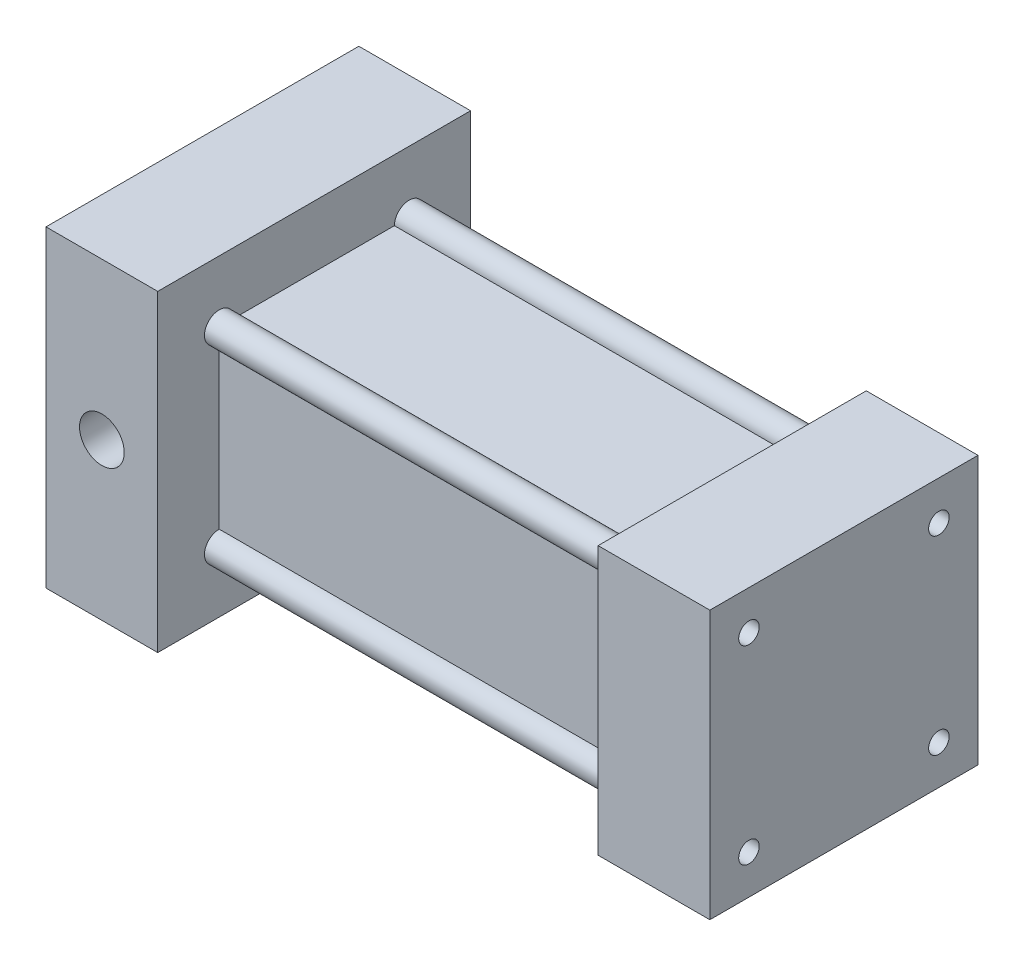
from build123d import *

# Parameters (mm, degrees)
SKETCH1_W           = 15.875
SKETCH1_H           = 44.45
BASE_EXTRUDE_DEPTH  = 22.225
SKETCH2_W           = 26.98496
SKETCH2_H           = 26.98496
BOSS_EXTRUDE1_DEPTH = 59.39536
SKETCH3_W           = 38.1
SKETCH3_H           = 38.1
BOSS_EXTRUDE2_DEPTH = 15.875
SKETCH4_R           = 2.09296
BOSS_EXTRUDE3_DEPTH = 59.39536
SKETCH5_R           = 1.45796
CUT_EXTRUDE1_DEPTH  = 75.27036
SKETCH6_R           = 4.7625
CUT_EXTRUDE2_DEPTH  = 75.27036
SKETCH8_R           = 3.175
CUT_EXTRUDE3_DEPTH  = 6.35


with BuildPart() as part:
    # Sketch1 → Base-Extrude (new, symmetric)
    with BuildSketch(Plane.XY):
        Rectangle(SKETCH1_W, SKETCH1_H)
    extrude(amount=BASE_EXTRUDE_DEPTH, both=True)

    # Sketch2 → Boss-Extrude1 (add)
    with BuildSketch(Plane(origin=(7.9375, 0, 0), x_dir=(0, 0, -1), z_dir=(1, 0, 0))):
        Rectangle(SKETCH2_W, SKETCH2_H)
    extrude(amount=BOSS_EXTRUDE1_DEPTH)

    # Sketch3 → Boss-Extrude2 (add)
    with BuildSketch(Plane(origin=(67.33286, -2.916482086, 3.369055623), x_dir=(0, 0, -1), z_dir=(1, 0, 0))):
        with Locations((3.369055623, 2.916482086)):
            Rectangle(SKETCH3_W, SKETCH3_H)
    extrude(amount=BOSS_EXTRUDE2_DEPTH)

    # Sketch4 → Boss-Extrude3 (add)
    with BuildSketch(Plane(origin=(7.9375, 0, 0), x_dir=(0, 0, -1), z_dir=(1, 0, 0))):
        with Locations((-13.49248, 13.49248)):
            Circle(SKETCH4_R)
        with Locations((-13.49248, -13.49248)):
            Circle(SKETCH4_R)
        with Locations((13.49248, 13.49248)):
            Circle(SKETCH4_R)
        with Locations((13.49248, -13.49248)):
            Circle(SKETCH4_R)
    extrude(amount=BOSS_EXTRUDE3_DEPTH)

    # Sketch5 → Cut-Extrude1 (cut)
    with BuildSketch(Plane(origin=(83.20786, 0, 0), x_dir=(0, 0, -1), z_dir=(1, 0, 0))):
        with Locations((-13.49248, 13.49248)):
            Circle(SKETCH5_R)
        with Locations((-13.49248, -13.49248)):
            Circle(SKETCH5_R)
        with Locations((13.49248, 13.49248)):
            Circle(SKETCH5_R)
        with Locations((13.49248, -13.49248)):
            Circle(SKETCH5_R)
    extrude(amount=-CUT_EXTRUDE1_DEPTH, mode=Mode.SUBTRACT)

    # Sketch6 → Cut-Extrude2 (cut)
    with BuildSketch(Plane.ZY.offset(7.9375)):
        Circle(SKETCH6_R)
    extrude(amount=-CUT_EXTRUDE2_DEPTH, mode=Mode.SUBTRACT)

    # Sketch8 → Cut-Extrude3 (cut)
    with BuildSketch(Plane.XY.offset(22.225)):
        Circle(SKETCH8_R)
    cut_extrude3 = extrude(amount=-CUT_EXTRUDE3_DEPTH, mode=Mode.SUBTRACT)

    # Mirror1: Cut-Extrude3 across plane
    add(cut_extrude3.mirror(Plane.XY), mode=Mode.SUBTRACT)


solid = part.part
